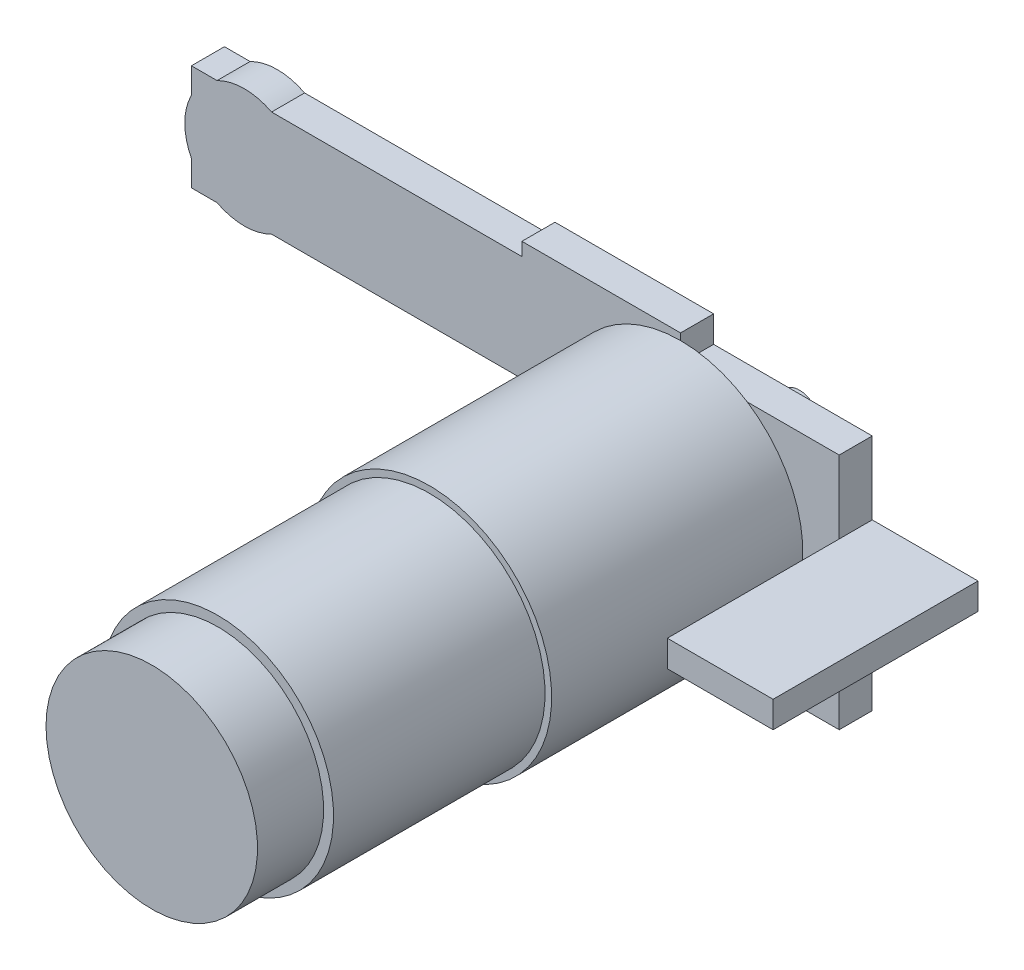
from build123d import *

# Parameters (mm, degrees)
SK_P02_MODULEPLATE_W  = 24
SK_P02_MODULEPLATE_H  = 5
P02_MODULEPLATE_DEPTH = 40
SK_P03_MODULEPLATE_W  = 24
SK_P03_MODULEPLATE_H  = 5
P03_MODULEPLATE_DEPTH = 36
P04_TRAILINGARM_START = 22
SK_P04_TRAILINGARM_W  = 50
SK_P04_TRAILINGARM_H  = 5
P04_TRAILINGARM_DEPTH = 16
P05_PIVOTBOSS_START   = -36
SK_P05_PIVOTBOSS_R    = 9
P05_PIVOTBOSS_DEPTH   = 5
P06_SPRINGTAB_START   = 21
SK_P06_SPRINGTAB_W    = 16
SK_P06_SPRINGTAB_H    = 31
P06_SPRINGTAB_DEPTH   = 4


with BuildPart() as part:
    # SK_P01_Gearmotor37Dwith64CPRenc → P01_Gearmotor37Dwith64CPRenc (revolve)
    with BuildSketch(Plane(origin=(0, 20.5, 0), x_dir=(1, 0, 0), z_dir=(0, 1, 0)), mode=Mode.PRIVATE) as p01_gearmotor37dwith64cprenc_sk:
        Polygon((17.5, 49), (20.5, 49), (20.5, 31), (36, 31), (36, -7), (35, -7), (35, -39), (33.5, -39), (33.5, -49), (17.5, -49), align=None)
    revolve(p01_gearmotor37dwith64cprenc_sk.sketch.rotate(Axis((17.5, 20.5, -54), (0, 0, 1)), 180), axis=Axis((17.5, 20.5, -54), (0, 0, 1)))

    # SK_P02_Moduleplate → P02_Moduleplate (add)
    with BuildSketch(Plane(origin=(0, 0, 0), x_dir=(1, 0, 0), z_dir=(0, 1, 0))):
        with Locations((5.5, 33.5)):
            Rectangle(SK_P02_MODULEPLATE_W, SK_P02_MODULEPLATE_H)
    extrude(amount=P02_MODULEPLATE_DEPTH)

    # SK_P03_Moduleplate → P03_Moduleplate (add)
    with BuildSketch(Plane(origin=(0, 0, 0), x_dir=(1, 0, 0), z_dir=(0, 1, 0))):
        with Locations((29.5, 33.5)):
            Rectangle(SK_P03_MODULEPLATE_W, SK_P03_MODULEPLATE_H)
    extrude(amount=P03_MODULEPLATE_DEPTH)

    # SK_P04_Trailingarm → P04_Trailingarm (add)
    with BuildSketch(Plane(origin=(0, 0, 0), x_dir=(1, 0, 0), z_dir=(0, 1, 0)).offset(P04_TRAILINGARM_START)):
        with Locations((-31.5, 33.5)):
            Rectangle(SK_P04_TRAILINGARM_W, SK_P04_TRAILINGARM_H)
    extrude(amount=P04_TRAILINGARM_DEPTH)

    # SK_P05_Pivotboss → P05_Pivotboss (add)
    with BuildSketch(Plane.XY.offset(P05_PIVOTBOSS_START)):
        with Locations((-48.5, 30)):
            Circle(SK_P05_PIVOTBOSS_R)
    extrude(amount=P05_PIVOTBOSS_DEPTH)

    # SK_P06_Springtab → P06_Springtab (add)
    with BuildSketch(Plane(origin=(0, 0, 0), x_dir=(1, 0, 0), z_dir=(0, 1, 0)).offset(P06_SPRINGTAB_START)):
        with Locations((49.5, 20.5)):
            Rectangle(SK_P06_SPRINGTAB_W, SK_P06_SPRINGTAB_H)
    extrude(amount=P06_SPRINGTAB_DEPTH)


solid = part.part
